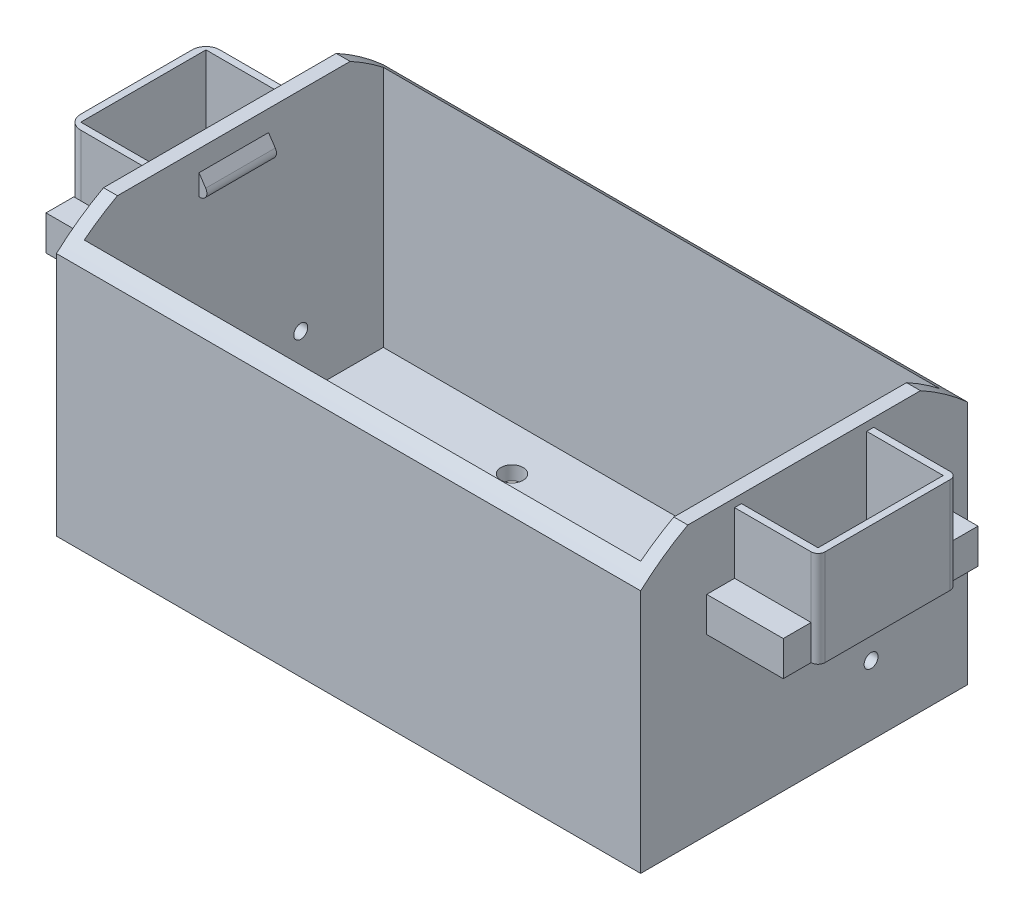
from build123d import *

# Parameters (mm, degrees)
SKETCH1_W               = 106.68
SKETCH1_H               = 59.69
SKETCH1_W_2             = 101.6
SKETCH1_H_2             = 54.61
BOSS_EXTRUDE1_DEPTH     = 50.8
SKETCH2_W               = 106.68
SKETCH2_H               = 59.69
BOSS_EXTRUDE2_DEPTH     = 2.54
SKETCH3_R               = 2.032
CUT_EXTRUDE1_DEPTH      = 2.54
BOSS_EXTRUDE3_START     = -31.75
SKETCH5_W               = 15.24
SKETCH5_H               = 25.4
BOSS_EXTRUDE3_DEPTH     = 17.526
SKETCH6_W               = 13.97
SKETCH6_H               = 22.86
CUT_EXTRUDE2_DEPTH      = 23.114
SKETCH8_R               = 1.27
CUT_EXTRUDE3_DEPTH      = 122.833947508
FILLET3_R               = 2.54
SKETCH9_R               = 4.7625
BOSS_EXTRUDE4_DEPTH     = 3.175
SKETCH11_R              = 2.38125
CUT_EXTRUDE4_DEPTH      = 88.330393621
BOSS_EXTRUDE5_DEPTH     = 6.35
FILLET4_R               = 1.27
FILLET4_OF_MIRROR2_R    = 1.27
FILLET6_R               = 1.27
SKETCH14_W              = 13.97
SKETCH14_H              = 5.08
BOSS_EXTRUDE6_DEPTH     = 6.35
MIRROR6_COPY_1_SKETCH_W = 13.97
MIRROR6_COPY_1_SKETCH_H = 5.08
MIRROR6_COPY_1_DEPTH    = 6.35
CUT_EXTRUDE5_DEPTH      = 127
SKETCH15_R              = 4.826
BOSS_EXTRUDE7_DEPTH     = 3.175


with BuildPart() as part:
    # Sketch1 → Boss-Extrude1 (new body)
    with BuildSketch(Plane(origin=(0, 0, 0), x_dir=(1, 0, 0), z_dir=(0, 1, 0))):
        Rectangle(SKETCH1_W, SKETCH1_H)
        Rectangle(SKETCH1_W_2, SKETCH1_H_2, mode=Mode.SUBTRACT)
    extrude(amount=BOSS_EXTRUDE1_DEPTH)

    # Sketch2 → Boss-Extrude2 (add)
    with BuildSketch(Plane(origin=(0, 0, 0), x_dir=(-1, 0, 0), z_dir=(0, -1, 0))):
        Rectangle(SKETCH2_W, SKETCH2_H)
    extrude(amount=-BOSS_EXTRUDE2_DEPTH)

    # Sketch3 → Cut-Extrude1 (cut)
    with BuildSketch(Plane.XZ):
        with Locations(Location((-19.05, 19.05, 0), (0, 0, 270))):
            Circle(SKETCH3_R)
        with Locations(Location((19.05, 19.05, 0), (0, 0, 270))):
            Circle(SKETCH3_R)
        with Locations(Location((19.05, -19.05, 0), (0, 0, 270))):
            Circle(SKETCH3_R)
        with Locations(Location((-19.05, -19.05, 0), (0, 0, 270))):
            Circle(SKETCH3_R)
    extrude(amount=-CUT_EXTRUDE1_DEPTH, mode=Mode.SUBTRACT)

    # Sketch5 → Boss-Extrude3 (add)
    with BuildSketch(Plane.XZ.offset(BOSS_EXTRUDE3_START)):
        with Locations((-60.96, 0)):
            Rectangle(SKETCH5_W, SKETCH5_H)
    boss_extrude3 = extrude(amount=-BOSS_EXTRUDE3_DEPTH)

    # Sketch6 → Cut-Extrude2 (cut)
    with BuildSketch(Plane(origin=(0, 49.276, 0), x_dir=(1, 0, 0), z_dir=(0, 1, 0))):
        with Locations((-60.325, 0)):
            Rectangle(SKETCH6_W, SKETCH6_H)
    cut_extrude2 = extrude(amount=-CUT_EXTRUDE2_DEPTH, mode=Mode.SUBTRACT)

    # Sketch8 → Cut-Extrude3 (cut)
    with BuildSketch(Plane(origin=(-53.34, -47.057304482, -0.79669661), x_dir=(0, 0, 1), z_dir=(-1, 0, 0))):
        with Locations((-11.43, 59.69)):
            Circle(SKETCH8_R)
    extrude(amount=-CUT_EXTRUDE3_DEPTH, mode=Mode.SUBTRACT)

    # Fillet3
    fillet3_edges = [part.edges().sort_by_distance(p)[0] for p in [
        (-68.58, 40.513, -12.7),
        (-68.58, 40.513, 12.7),
    ]]
    fillet(fillet3_edges, radius=FILLET3_R)

    # Sketch9 → Boss-Extrude4 (add)
    with BuildSketch(Plane(origin=(0, 2.54, 0), x_dir=(1, 0, 0), z_dir=(0, 1, 0))):
        with Locations(Location((0, 0, 0), (0, 0, 270))):
            Circle(SKETCH9_R)
    extrude(amount=BOSS_EXTRUDE4_DEPTH)

    # Sketch11 → Cut-Extrude4 (cut, through all)
    with BuildSketch(Plane(origin=(0, 5.715, 0), x_dir=(1, 0, 0), z_dir=(0, 1, 0))):
        with Locations(Location((0, 0, 0), (0, 0, 270))):
            Circle(SKETCH11_R)
    extrude(amount=-CUT_EXTRUDE4_DEPTH, mode=Mode.SUBTRACT)

    # Sketch13 → Boss-Extrude5 (add, symmetric)
    with BuildSketch(Plane.XY):
        Polygon((-50.8, 46.99), (-48.26, 43.18), (-50.8, 43.18), align=None)
    boss_extrude5 = extrude(amount=BOSS_EXTRUDE5_DEPTH, both=True)

    # Fillet4
    fillet4_edges = [part.edges().sort_by_distance(p)[0] for p in [
        (-48.26, 43.18, 0),
    ]]
    fillet(fillet4_edges, radius=FILLET4_R)

    # Mirror2: Boss-Extrude5 across plane
    add(boss_extrude5.mirror(Plane(origin=(0, 0, 0), x_dir=(0, 0, 1), z_dir=(1, 0, 0))))

    # Fillet4 of Mirror2
    fillet4_of_mirror2_edges = [part.edges().sort_by_distance(p)[0] for p in [
        (48.26, 43.18, 0),
    ]]
    fillet(fillet4_of_mirror2_edges, radius=FILLET4_OF_MIRROR2_R)

    # Mirror4: Boss-Extrude3, Cut-Extrude2 across plane
    add(boss_extrude3.mirror(Plane(origin=(0, 0, 0), x_dir=(0, 0, 1), z_dir=(1, 0, 0))))
    add(cut_extrude2.mirror(Plane(origin=(0, 0, 0), x_dir=(0, 0, 1), z_dir=(1, 0, 0))), mode=Mode.SUBTRACT)

    # Fillet6
    fillet6_edges = [part.edges().sort_by_distance(p)[0] for p in [
        (68.58, 40.513, 12.7),
        (68.58, 40.513, -12.7),
    ]]
    fillet(fillet6_edges, radius=FILLET6_R)

    # Sketch14 → Boss-Extrude6 (add)
    with BuildSketch(Plane.XZ.offset(-31.75)):
        with Locations((-60.325, 15.24)):
            Rectangle(SKETCH14_W, SKETCH14_H)
    boss_extrude6 = extrude(amount=-BOSS_EXTRUDE6_DEPTH)

    # Mirror5: Boss-Extrude6 across plane
    add(boss_extrude6.mirror(Plane.XY))

    # Mirror6: Boss-Extrude6 across plane
    add(boss_extrude6.mirror(Plane(origin=(0, 0, 0), x_dir=(0, 0, 1), z_dir=(1, 0, 0))))

    # Mirror6 copy 1 sketch → Mirror6 copy 1 (add)
    with BuildSketch(Plane(origin=(0, 31.75, 0), x_dir=(-1, 0, 0), z_dir=(0, -1, 0))):
        with Locations((-60.325, 15.24)):
            Rectangle(MIRROR6_COPY_1_SKETCH_W, MIRROR6_COPY_1_SKETCH_H)
    extrude(amount=-MIRROR6_COPY_1_DEPTH)

    # Sketch12 → Cut-Extrude5 (cut, symmetric)
    with BuildSketch(Plane(origin=(0, 0, 0), x_dir=(0, 0, -1), z_dir=(1, 0, 0))):
        with BuildLine():
            Line((-29.845, 50.8), (-29.845, 44.694509634))
            ThreePointArc((-29.845, 44.694509634), (-25.725135532, 48.003392702), (-21.241724106, 50.8))
            Line((-21.241724106, 50.8), (-29.845, 50.8))
        make_face()
        with BuildLine():
            Line((29.845, 50.8), (21.241724106, 50.8))
            ThreePointArc((21.241724106, 50.8), (25.725135532, 48.003392702), (29.845, 44.694509634))
            Line((29.845, 44.694509634), (29.845, 50.8))
        make_face()
    extrude(amount=CUT_EXTRUDE5_DEPTH, both=True, mode=Mode.SUBTRACT)

    # Sketch15 → Boss-Extrude7 (add)
    with BuildSketch(Plane(origin=(0, 2.54, 0), x_dir=(1, 0, 0), z_dir=(0, 1, 0))):
        with Locations(Location((-29.21, 0, 0), (0, 0, 270))):
            Circle(SKETCH15_R)
        with Locations(Location((29.21, 0, 0), (0, 0, 270))):
            Circle(SKETCH15_R)
    extrude(amount=BOSS_EXTRUDE7_DEPTH)


solid = part.part
